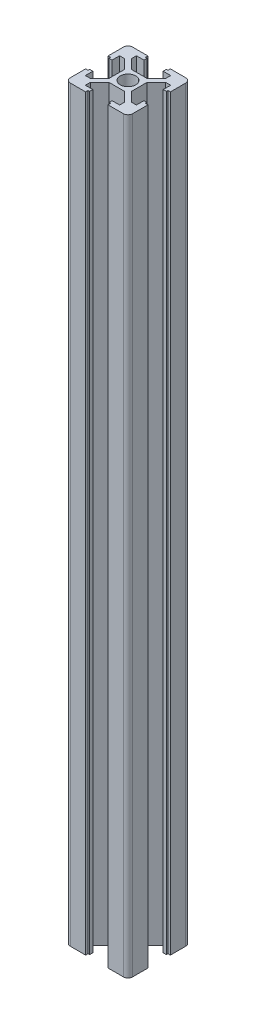
from build123d import *

# Parameters (mm, degrees)
SKETCH_1_R      = 2.5
EXTRUDE_1_DEPTH = 240


with BuildPart() as part:
    # 草图1 → 凸台-拉伸1 (new body)
    with BuildSketch(Plane(origin=(0, 0, 0), x_dir=(1, 0, 0), z_dir=(0, 1, 0))):
        with BuildLine():
            Line((-4.415608984, 3.873972711), (-4.415608984, -1.204706946))
            Line((-4.415608984, -1.204706946), (-7.376269156, -4.165367117))
            Line((-7.376269156, -4.165367117), (-9.015608984, -4.165367117))
            Line((-9.015608984, -4.165367117), (-9.015608984, -1.765367117))
            Line((-9.015608984, -1.765367117), (-10.015608984, -1.765367117))
            Line((-10.015608984, -1.765367117), (-10.015608984, -2.265367117))
            Line((-10.015608984, -2.265367117), (-10.815608984, -2.265367117))
            Line((-10.815608984, -2.265367117), (-10.815608984, -7.165367117))
            ThreePointArc((-10.815608984, -7.165367117), (-10.376269156, -8.226027289), (-9.315608984, -8.665367117))
            Line((-9.315608984, -8.665367117), (-4.415608984, -8.665367117))
            Line((-4.415608984, -8.665367117), (-4.415608984, -7.865367117))
            Line((-4.415608984, -7.865367117), (-3.915608984, -7.865367117))
            Line((-3.915608984, -7.865367117), (-3.915608984, -6.865367117))
            Line((-3.915608984, -6.865367117), (-6.315608984, -6.865367117))
            Line((-6.315608984, -6.865367117), (-6.315608984, -5.226027289))
            Line((-6.315608984, -5.226027289), (-3.354948812, -2.265367117))
            Line((-3.354948812, -2.265367117), (1.723730844, -2.265367117))
            Line((1.723730844, -2.265367117), (4.684391016, -5.226027289))
            Line((4.684391016, -5.226027289), (4.684391016, -6.865367117))
            Line((4.684391016, -6.865367117), (2.284391016, -6.865367117))
            Line((2.284391016, -6.865367117), (2.284391016, -7.865367117))
            Line((2.284391016, -7.865367117), (2.784391016, -7.865367117))
            Line((2.784391016, -7.865367117), (2.784391016, -8.665367117))
            Line((2.784391016, -8.665367117), (7.684391016, -8.665367117))
            ThreePointArc((7.684391016, -8.665367117), (8.745051188, -8.226027289), (9.184391016, -7.165367117))
            Line((9.184391016, -7.165367117), (9.184391016, -2.265367117))
            Line((9.184391016, -2.265367117), (8.384391016, -2.265367117))
            Line((8.384391016, -2.265367117), (8.384391016, -1.765367117))
            Line((8.384391016, -1.765367117), (7.384391016, -1.765367117))
            Line((7.384391016, -1.765367117), (7.384391016, -4.165367117))
            Line((7.384391016, -4.165367117), (5.745051188, -4.165367117))
            Line((5.745051188, -4.165367117), (2.784391016, -1.204706946))
            Line((2.784391016, -1.204706946), (2.784391016, 3.873972711))
            Line((2.784391016, 3.873972711), (5.745051188, 6.834632883))
            Line((5.745051188, 6.834632883), (7.384391016, 6.834632883))
            Line((7.384391016, 6.834632883), (7.384391016, 4.434632883))
            Line((7.384391016, 4.434632883), (8.384391016, 4.434632883))
            Line((8.384391016, 4.434632883), (8.384391016, 4.934632883))
            Line((8.384391016, 4.934632883), (9.184391016, 4.934632883))
            Line((9.184391016, 4.934632883), (9.184391016, 9.834632883))
            ThreePointArc((9.184391016, 9.834632883), (8.745051188, 10.895293054), (7.684391016, 11.334632883))
            Line((7.684391016, 11.334632883), (2.784391016, 11.334632883))
            Line((2.784391016, 11.334632883), (2.784391016, 10.534632883))
            Line((2.784391016, 10.534632883), (2.284391016, 10.534632883))
            Line((2.284391016, 10.534632883), (2.284391016, 9.534632883))
            Line((2.284391016, 9.534632883), (4.684391016, 9.534632883))
            Line((4.684391016, 9.534632883), (4.684391016, 7.895293054))
            Line((4.684391016, 7.895293054), (1.723730844, 4.934632883))
            Line((1.723730844, 4.934632883), (-3.354948812, 4.934632883))
            Line((-3.354948812, 4.934632883), (-6.315608984, 7.895293054))
            Line((-6.315608984, 7.895293054), (-6.315608984, 9.534632883))
            Line((-6.315608984, 9.534632883), (-3.915608984, 9.534632883))
            Line((-3.915608984, 9.534632883), (-3.915608984, 10.534632883))
            Line((-3.915608984, 10.534632883), (-4.415608984, 10.534632883))
            Line((-4.415608984, 10.534632883), (-4.415608984, 11.334632883))
            Line((-4.415608984, 11.334632883), (-9.315608984, 11.334632883))
            ThreePointArc((-9.315608984, 11.334632883), (-10.376269156, 10.895293054), (-10.815608984, 9.834632883))
            Line((-10.815608984, 9.834632883), (-10.815608984, 4.934632883))
            Line((-10.815608984, 4.934632883), (-10.015608984, 4.934632883))
            Line((-10.015608984, 4.934632883), (-10.015608984, 4.434632883))
            Line((-10.015608984, 4.434632883), (-9.015608984, 4.434632883))
            Line((-9.015608984, 4.434632883), (-9.015608984, 6.834632883))
            Line((-9.015608984, 6.834632883), (-7.376269156, 6.834632883))
            Line((-7.376269156, 6.834632883), (-4.415608984, 3.873972711))
        make_face()
        with Locations(Location((-0.815608984, 1.334632883, 0), (0, 0, 270))):
            Circle(SKETCH_1_R, mode=Mode.SUBTRACT)
    extrude(amount=EXTRUDE_1_DEPTH)


solid = part.part
